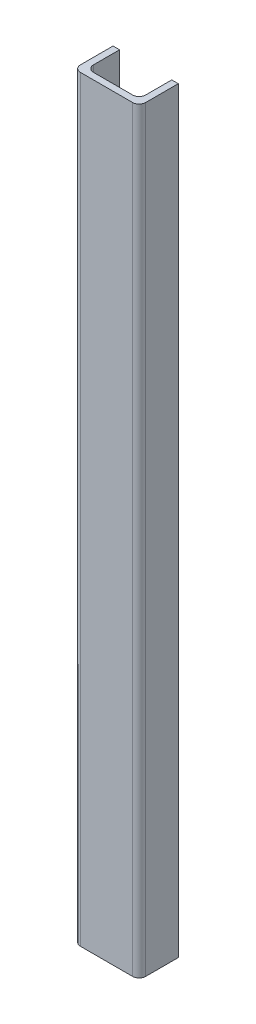
from build123d import *

# Parameters (mm, degrees)
BOSS_EXTRUDE2_DEPTH = 580


with BuildPart() as part:
    # Sketch1 → Boss-Extrude2 (new body)
    with BuildSketch(Plane(origin=(0, 0, 0), x_dir=(1, 0, 0), z_dir=(0, 1, 0))):
        with BuildLine():
            Line((-15, 2.5), (15, 2.5))
            ThreePointArc((15, 2.5), (18.535533906, 3.964466094), (20, 7.5))
            Line((20, 7.5), (20, 27.5))
            Line((20, 27.5), (25, 27.5))
            Line((25, 27.5), (25, 2.5))
            ThreePointArc((25, 2.5), (23.535533906, -1.035533906), (20, -2.5))
            Line((20, -2.5), (-20, -2.5))
            ThreePointArc((-20, -2.5), (-23.535533906, -1.035533906), (-25, 2.5))
            Line((-25, 2.5), (-25, 27.5))
            Line((-25, 27.5), (-20, 27.5))
            Line((-20, 27.5), (-20, 7.5))
            ThreePointArc((-20, 7.5), (-18.535533906, 3.964466094), (-15, 2.5))
        make_face()
    extrude(amount=BOSS_EXTRUDE2_DEPTH)


solid = part.part
